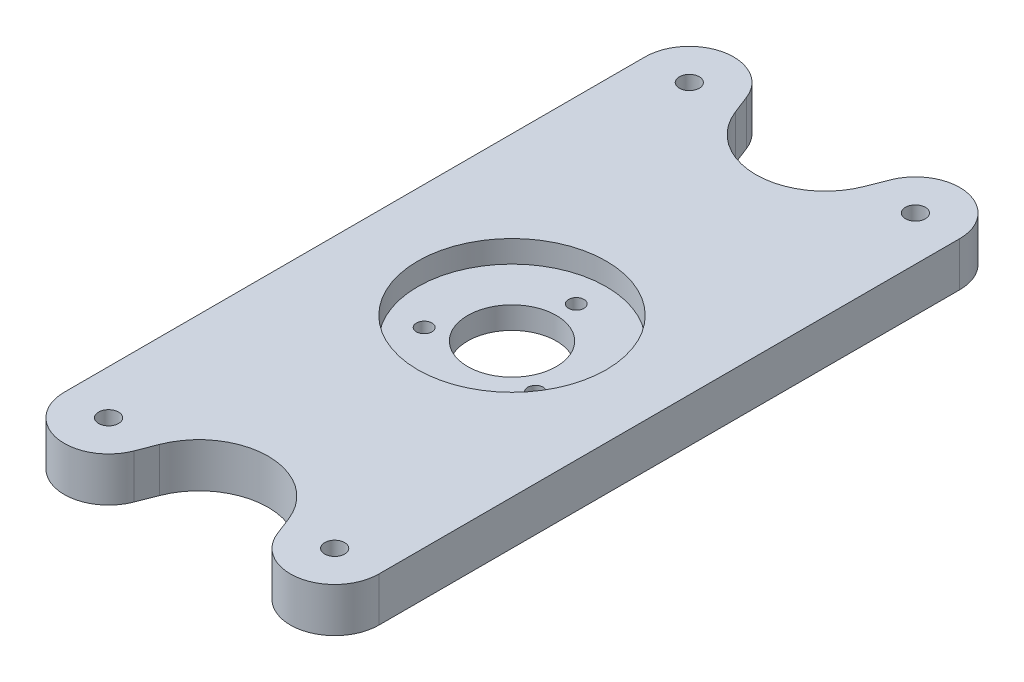
from build123d import *

# Parameters (mm, degrees)
SKETCH1_R           = 2.25
EXTRUDE_1_DEPTH     = 10
SKETCH_1_R          = 21.25
CUT_EXTRUDE_1_DEPTH = 5
SKETCH_2_R          = 1.75
SKETCH_2_R_2        = 10
CUT_EXTRUDE_2_DEPTH = 5


with BuildPart() as part:
    # Sketch1 → 凸台-拉伸1 (new body)
    with BuildSketch(Plane(origin=(0, 0, 0), x_dir=(1, 0, 0), z_dir=(0, 1, 0))):
        with BuildLine():
            Line((-16.181288894, 69.127895164), (-14.556112863, 64.953423399))
            ThreePointArc((-14.556112863, 64.953423399), (0, 55), (14.556112863, 64.953423399))
            Line((14.556112863, 64.953423399), (16.181288894, 69.127895164))
            ThreePointArc((16.181288894, 69.127895164), (27.345655566, 75.32820205), (35.5, 65.5))
            Line((35.5, 65.5), (35.5, -65.5))
            ThreePointArc((35.5, -65.5), (27.345655566, -75.32820205), (16.181288894, -69.127895164))
            Line((16.181288894, -69.127895164), (14.556112863, -64.953423399))
            ThreePointArc((14.556112863, -64.953423399), (0, -55), (-14.556112863, -64.953423399))
            Line((-14.556112863, -64.953423399), (-16.181288894, -69.127895164))
            ThreePointArc((-16.181288894, -69.127895164), (-27.345655566, -75.32820205), (-35.5, -65.5))
            Line((-35.5, -65.5), (-35.5, 65.5))
            ThreePointArc((-35.5, 65.5), (-27.345655566, 75.32820205), (-16.181288894, 69.127895164))
        make_face()
        with Locations(Location((25.5, 65.5, 0), (0, 0, 270))):
            Circle(SKETCH1_R, mode=Mode.SUBTRACT)
        with Locations(Location((-25.5, 65.5, 0), (0, 0, 270))):
            Circle(SKETCH1_R, mode=Mode.SUBTRACT)
        with Locations(Location((-25.5, -65.5, 0), (0, 0, 270))):
            Circle(SKETCH1_R, mode=Mode.SUBTRACT)
        with Locations(Location((25.5, -65.5, 0), (0, 0, 270))):
            Circle(SKETCH1_R, mode=Mode.SUBTRACT)
    extrude(amount=EXTRUDE_1_DEPTH)

    # 草图1 → 切除-拉伸1 (cut)
    with BuildSketch(Plane(origin=(0, 10, 0), x_dir=(1, 0, 0), z_dir=(0, 1, 0))):
        with Locations(Location((0, 0, 0), (0, 0, 270))):
            Circle(SKETCH_1_R)
    extrude(amount=-CUT_EXTRUDE_1_DEPTH, mode=Mode.SUBTRACT)

    # 草图2 → 切除-拉伸2 (cut)
    with BuildSketch(Plane(origin=(0, 5, 0), x_dir=(1, 0, 0), z_dir=(0, 1, 0))):
        with Locations(Location((0, 14.5, 0), (0, 0, 270))):
            Circle(SKETCH_2_R)
        with Locations(Location((12.557368355, -7.25, 0), (0, 0, 270))):
            Circle(SKETCH_2_R)
        with Locations(Location((-12.557368355, -7.25, 0), (0, 0, 270))):
            Circle(SKETCH_2_R)
        with Locations(Location((0, 0, 0), (0, 0, 270))):
            Circle(SKETCH_2_R_2)
    extrude(amount=-CUT_EXTRUDE_2_DEPTH, mode=Mode.SUBTRACT)


solid = part.part
